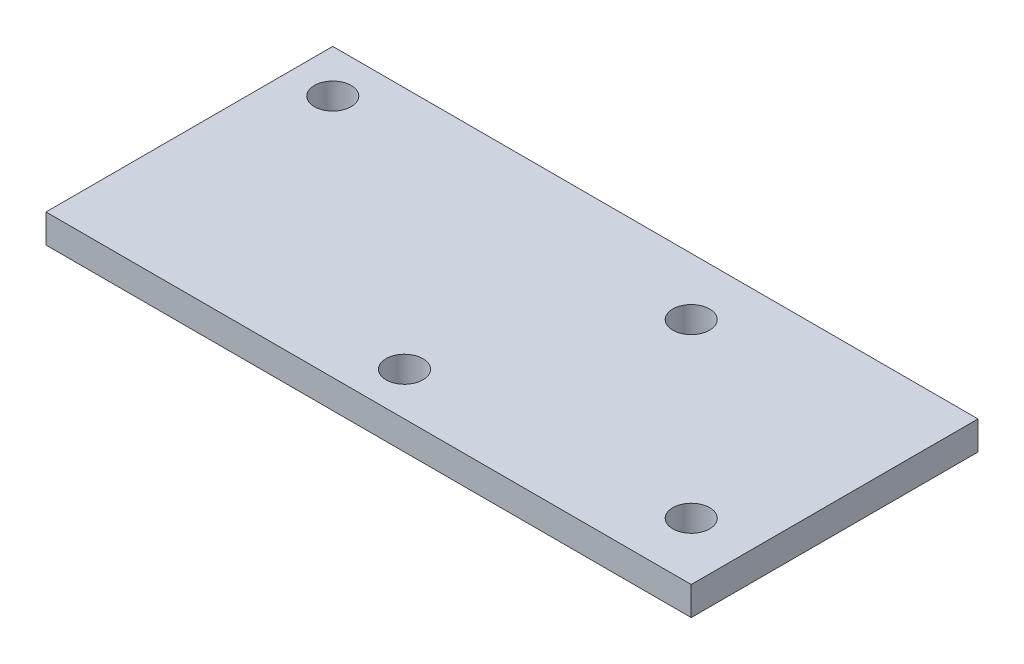
from build123d import *

# Parameters (mm, degrees)
SKETCH1_W             = 57.15
SKETCH1_H             = 25.4
BOSS_EXTRUDE1_DEPTH   = 2.54
F_4_CLEARANCE_HOLE1_D = 3.2639


with BuildPart() as part:
    # Sketch1 → Boss-Extrude1 (new body)
    with BuildSketch(Plane(origin=(0, 0, 0), x_dir=(1, 0, 0), z_dir=(0, 1, 0))):
        Rectangle(SKETCH1_W, SKETCH1_H)
    extrude(amount=BOSS_EXTRUDE1_DEPTH)

    # #4 Clearance Hole1 (through all)
    with Locations(Plane(origin=(0, 2.54, 0), x_dir=(1, 0, 0), z_dir=(0, 1, 0))):
        with Locations((-24.765, 8.89), (-0.635, -8.89), (8.255, 7.62), (23.495, -7.62)):
            Hole(F_4_CLEARANCE_HOLE1_D / 2)


solid = part.part
